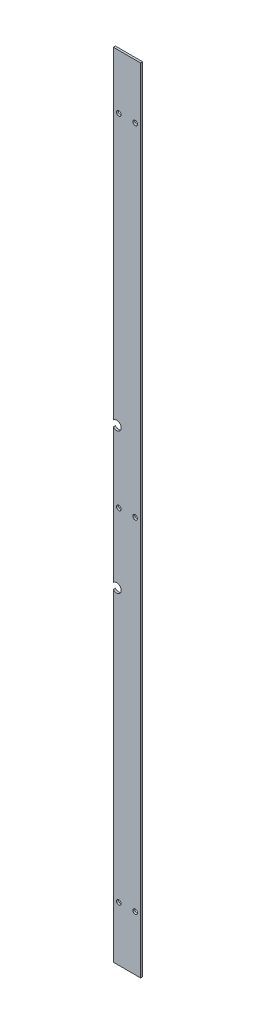
from build123d import *

# Parameters (mm, degrees)
MAIN_PROFILE_SKETCH_R = 1.7
MAIN_EXTRUSION_DEPTH  = 1.5


with BuildPart() as part:
    # Main Profile Sketch → Main Extrusion (new body)
    with BuildSketch(Plane.XY.offset(110)):
        with BuildLine():
            Line((72.5, 49.345934077), (72.5, -49.345934077))
            ThreePointArc((72.5, -49.345934077), (76.148912529, -48.40645834), (78.3, -51.5))
            ThreePointArc((78.3, -51.5), (76.148912529, -54.59354166), (72.5, -53.654065923))
            Line((72.5, -53.654065923), (72.5, -290))
            Line((72.5, -290), (92.5, -290))
            Line((92.5, -290), (92.5, 290))
            Line((92.5, 290), (72.5, 290))
            Line((72.5, 290), (72.5, 53.654065923))
            ThreePointArc((72.5, 53.654065923), (76.148912529, 54.59354166), (78.3, 51.5))
            ThreePointArc((78.3, 51.5), (76.148912529, 48.40645834), (72.5, 49.345934077))
        make_face()
        with Locations((76.5, -250)):
            Circle(MAIN_PROFILE_SKETCH_R, mode=Mode.SUBTRACT)
        with Locations((88.5, -250)):
            Circle(MAIN_PROFILE_SKETCH_R, mode=Mode.SUBTRACT)
        with Locations((76.5, 0)):
            Circle(MAIN_PROFILE_SKETCH_R, mode=Mode.SUBTRACT)
        with Locations((76.5, 250)):
            Circle(MAIN_PROFILE_SKETCH_R, mode=Mode.SUBTRACT)
        with Locations((88.5, 0)):
            Circle(MAIN_PROFILE_SKETCH_R, mode=Mode.SUBTRACT)
        with Locations((88.5, 250)):
            Circle(MAIN_PROFILE_SKETCH_R, mode=Mode.SUBTRACT)
    extrude(amount=-MAIN_EXTRUSION_DEPTH)


solid = part.part
